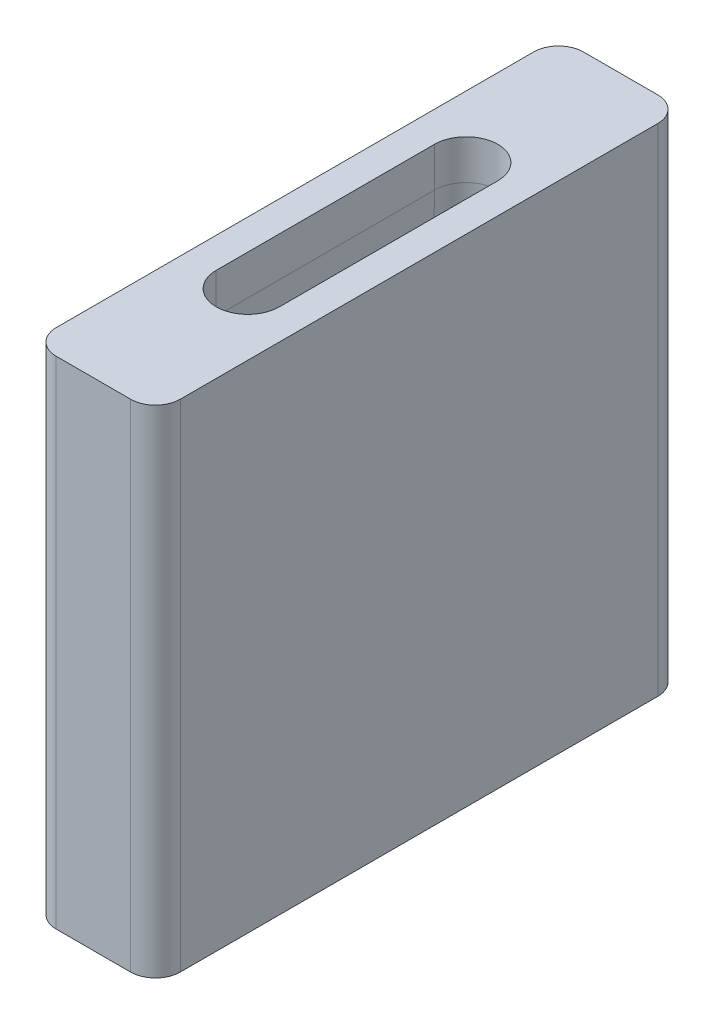
from build123d import *

# Parameters (mm, degrees)
BOSS_EXTRUDE1_DEPTH         = 40
CUT_EXTRUDE2_REACH          = 47.569
M6_TAPPED_HOLE1_D           = 5
M6_TAPPED_HOLE1_DEPTH       = 17
M6_TAPPED_HOLE1_CSINK_D     = 6.05
M6_TAPPED_HOLE1_CSINK_ANGLE = 90
M6_TAPPED_HOLE1_TIP         = 1.502151548


with BuildPart() as part:
    # Sketch1 → Boss-Extrude1 (new body)
    with BuildSketch(Plane(origin=(0, 0, 0), x_dir=(1, 0, 0), z_dir=(0, 1, 0))):
        with BuildLine():
            Line((-3, -21.25), (3, -21.25))
            ThreePointArc((3, -21.25), (4.414213562, -20.664213562), (5, -19.25))
            Line((5, -19.25), (5, 19.25))
            ThreePointArc((5, 19.25), (4.414213562, 20.664213562), (3, 21.25))
            Line((3, 21.25), (-3, 21.25))
            ThreePointArc((-3, 21.25), (-4.414213562, 20.664213562), (-5, 19.25))
            Line((-5, 19.25), (-5, -19.25))
            ThreePointArc((-5, -19.25), (-4.414213562, -20.664213562), (-3, -21.25))
        make_face()
    extrude(amount=-BOSS_EXTRUDE1_DEPTH)

    # Sketch5 → Cut-Extrude2 (cut, up to next)
    with BuildSketch(Plane(origin=(0, 0, 0), x_dir=(1, 0, 0), z_dir=(0, 1, 0)), mode=Mode.PRIVATE) as cut_extrude2_sk1:
        with BuildLine():
            Line((-2.55, -8.8), (-2.55, 8.8))
            ThreePointArc((-2.55, 8.8), (0, 11.35), (2.55, 8.8))
            Line((2.55, 8.8), (2.55, -8.8))
            ThreePointArc((2.55, -8.8), (0, -11.35), (-2.55, -8.8))
        make_face()
    cut_extrude2_tool1 = extrude(cut_extrude2_sk1.sketch, amount=-CUT_EXTRUDE2_REACH, mode=Mode.PRIVATE) & part.part
    add(cut_extrude2_tool1.solids().sort_by_distance((0, 0, 0))[0], mode=Mode.SUBTRACT)

    # Cut-Sweep1: sweep along a path in Sketch8
    with BuildLine(Plane(origin=(0, 0, 0), x_dir=(1, 0, 0), z_dir=(0, 1, 0))) as cut_sweep1_path:
        Line((-2.55, 8.8), (-2.55, -8.8))
        ThreePointArc((-2.55, -8.8), (0, -11.35), (2.55, -8.8))
        Line((2.55, -8.8), (2.55, 8.8))
        ThreePointArc((2.55, 8.8), (0, 11.35), (-2.55, 8.8))
    # Sketch7 → Cut-Sweep1 (sweep, cut)
    with BuildSketch(Plane.XY):
        Polygon((2.55, -3.2), (3.192346389, -40), (2.55, -40), align=None)
    sweep(path=cut_sweep1_path.line, mode=Mode.SUBTRACT)

    # M6 Tapped Hole1
    with Locations(Plane(origin=(0, -40, 0), x_dir=(-1, 0, 0), z_dir=(0, -1, 0))):
        with Locations((0, 16.25), (0, -16.25)):
            CounterSinkHole(M6_TAPPED_HOLE1_D / 2, M6_TAPPED_HOLE1_CSINK_D / 2, depth=M6_TAPPED_HOLE1_DEPTH, counter_sink_angle=M6_TAPPED_HOLE1_CSINK_ANGLE)
            with Locations((0, 0, -(M6_TAPPED_HOLE1_DEPTH + M6_TAPPED_HOLE1_TIP / 2))):  # 118° drill point
                Cone(0, M6_TAPPED_HOLE1_D / 2, M6_TAPPED_HOLE1_TIP, mode=Mode.SUBTRACT)


solid = part.part
